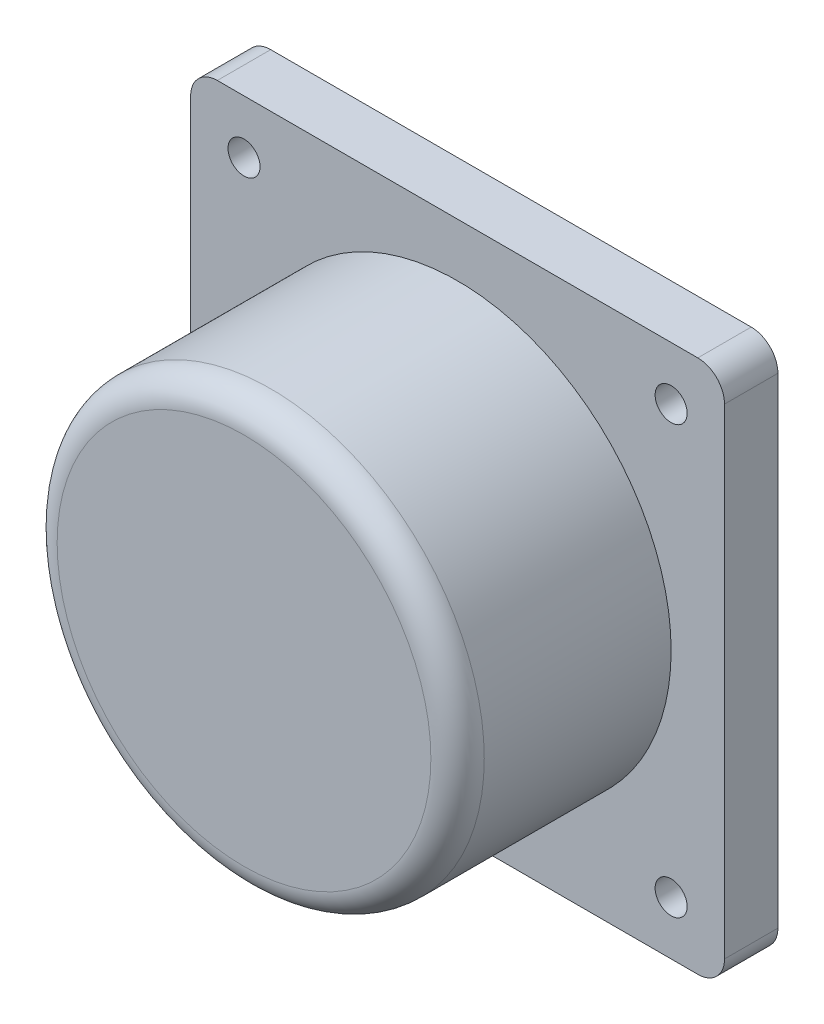
from build123d import *

# Parameters (mm, degrees)
SKETCH1_W           = 100
SKETCH1_H           = 100
SKETCH1_R           = 3
BOSS_EXTRUDE1_DEPTH = 10
SKETCH2_R           = 40
BOSS_EXTRUDE2_DEPTH = 40
FILLET1_R           = 5


with BuildPart() as part:
    # Sketch1 → Boss-Extrude1 (new body)
    with BuildSketch(Plane.XY):
        Rectangle(SKETCH1_W, SKETCH1_H)
        with Locations((40, 40)):
            Circle(SKETCH1_R, mode=Mode.SUBTRACT)
        with Locations(Location((-40, 40, 0), (0, 0, 180))):
            Circle(SKETCH1_R, mode=Mode.SUBTRACT)
        with Locations((-40, -40)):
            Circle(SKETCH1_R, mode=Mode.SUBTRACT)
        with Locations(Location((40, -40, 0), (0, 0, 180))):
            Circle(SKETCH1_R, mode=Mode.SUBTRACT)
    extrude(amount=BOSS_EXTRUDE1_DEPTH)

    # Sketch2 → Boss-Extrude2 (add)
    with BuildSketch(Plane.XY.offset(10)):
        Circle(SKETCH2_R)
    extrude(amount=BOSS_EXTRUDE2_DEPTH)

    # Fillet1
    fillet1_edges = [part.edges().sort_by_distance(p)[0] for p in [
        (-40, 0, 50),
        (50, -50, 5),
        (-50, -50, 5),
        (-50, 50, 5),
        (50, 50, 5),
    ]]
    fillet(fillet1_edges, radius=FILLET1_R)


solid = part.part
